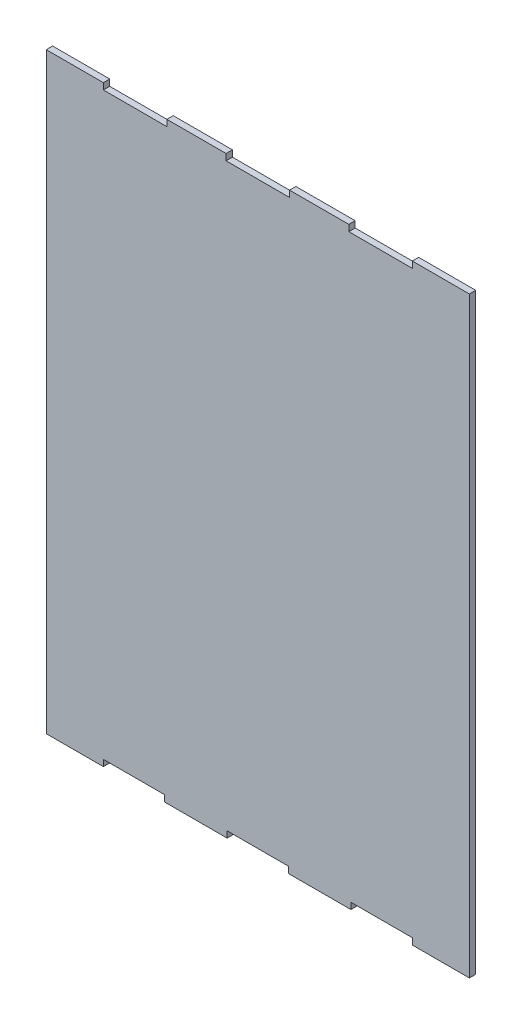
from build123d import *

# Parameters (mm, degrees)
EXTRUDE_1_DEPTH = 3


with BuildPart() as part:
    # 草圖1 → 填料-伸長1 (new body)
    with BuildSketch(Plane.XY):
        Polygon((76, 140), (103, 140), (103, -140), (76, -140), (76, -137), (47, -137), (47, -140), (17.5, -140), (17.5, -137), (-11.5, -137), (-11.5, -140), (-41, -140), (-41, -137), (-70, -137), (-70, -140), (-97, -140), (-97, 140), (-70, 140), (-70, 137), (-40, 137), (-40, 140), (-12, 140), (-12, 137), (18, 137), (18, 140), (46, 140), (46, 137), (76, 137), align=None)
    extrude(amount=EXTRUDE_1_DEPTH)


solid = part.part
